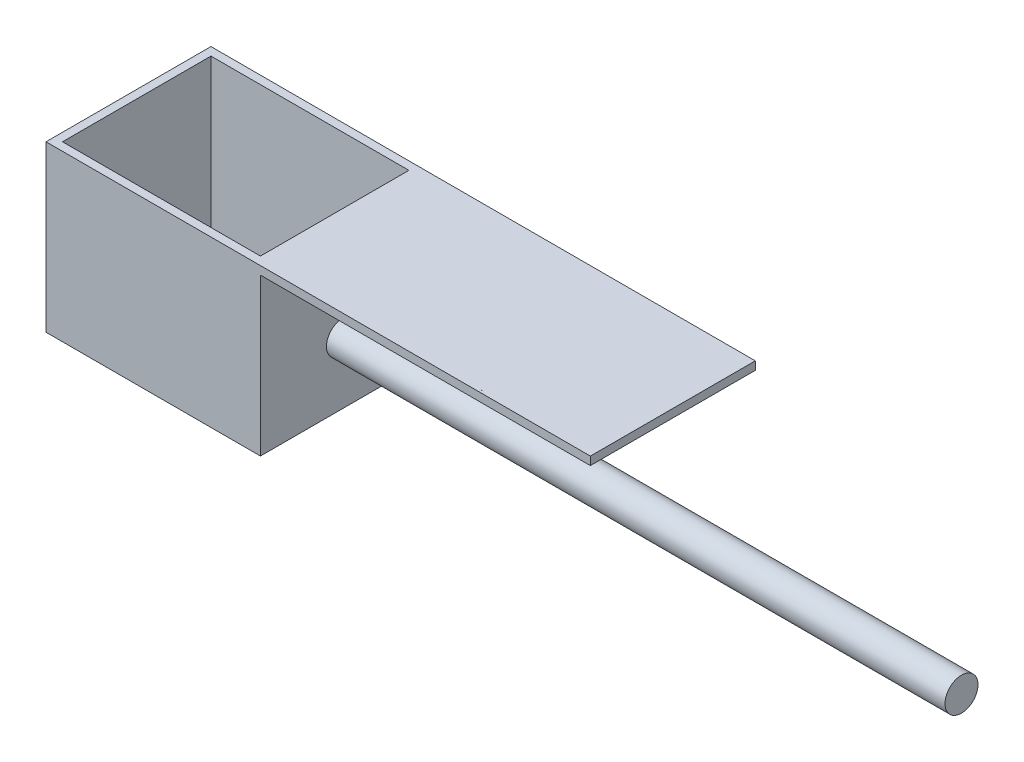
from build123d import *

# Parameters (mm, degrees)
SKETCH1_W           = 52
SKETCH1_H           = 40
SKETCH1_W_2         = 48
SKETCH1_H_2         = 36
BOSS_EXTRUDE1_DEPTH = 40
SKETCH2_W           = 40
SKETCH2_H           = 2
BOSS_EXTRUDE2_DEPTH = 80
SKETCH3_R           = 4
BOSS_EXTRUDE3_DEPTH = 150


with BuildPart() as part:
    # Sketch1 → Boss-Extrude1 (new body)
    with BuildSketch(Plane(origin=(0, 0, 0), x_dir=(1, 0, 0), z_dir=(0, 1, 0))):
        with Locations((26, -20)):
            Rectangle(SKETCH1_W, SKETCH1_H)
        with Locations((26, -20)):
            Rectangle(SKETCH1_W_2, SKETCH1_H_2, mode=Mode.SUBTRACT)
    extrude(amount=BOSS_EXTRUDE1_DEPTH)

    # Sketch2 → Boss-Extrude2 (add)
    with BuildSketch(Plane(origin=(52, 0, 0), x_dir=(0, 0, -1), z_dir=(1, 0, 0))):
        with Locations((-20, 39)):
            Rectangle(SKETCH2_W, SKETCH2_H)
    extrude(amount=BOSS_EXTRUDE2_DEPTH)

    # Sketch3 → Boss-Extrude3 (add)
    with BuildSketch(Plane(origin=(52, 0, 0), x_dir=(0, 0, -1), z_dir=(1, 0, 0))):
        with Locations(Location((-20, 15, 0), (0, 0, 180))):
            Circle(SKETCH3_R)
    extrude(amount=BOSS_EXTRUDE3_DEPTH)


solid = part.part
